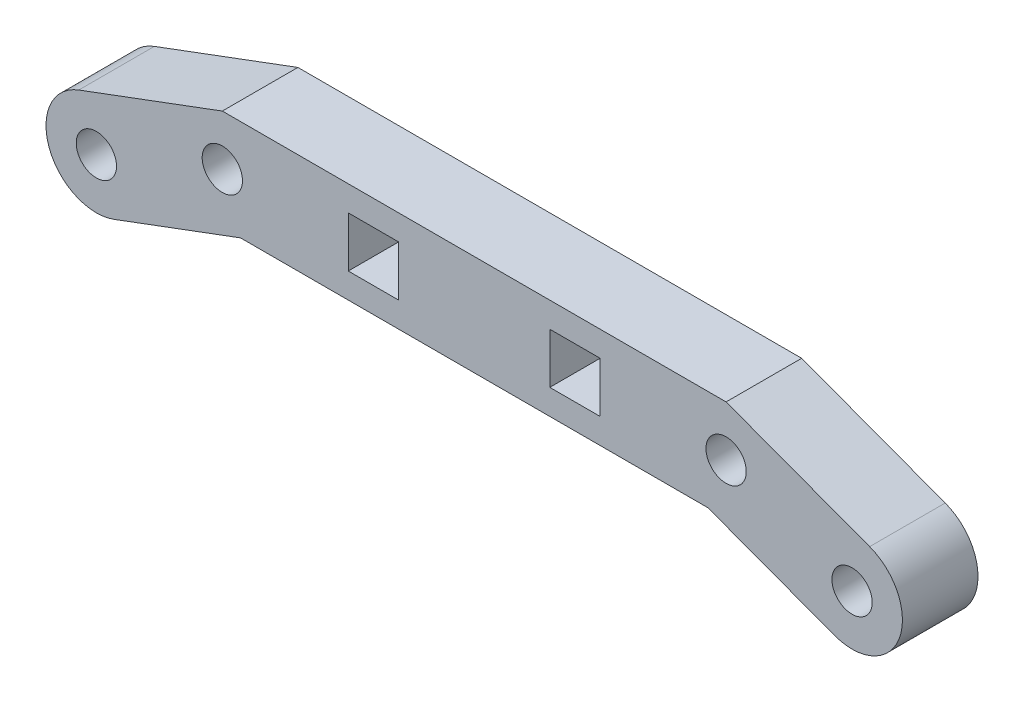
from build123d import *

# Parameters (mm, degrees)
ESBO_O1_R                = 4
ESBO_O1_W                = 10
ESBO_O1_H                = 10
RESSALTO_EXTRUS_O1_DEPTH = 15


with BuildPart() as part:
    # Esboço1 → Ressalto-extrusão1 (new body)
    with BuildSketch(Plane.XY):
        with BuildLine():
            Line((78.495378078, -10.630777402), (50, 0))
            Line((50, 0), (0, 0))
            Line((0, 0), (-50, 0))
            Line((-50, 0), (-78.495378078, -10.630777402))
            ThreePointArc((-78.495378078, -10.630777402), (-84.369222598, -23.495378078), (-71.504621922, -29.369222598))
            Line((-71.504621922, -29.369222598), (-46.390791566, -20))
            Line((-46.390791566, -20), (46.390791566, -20))
            Line((46.390791566, -20), (71.504621922, -29.369222598))
            ThreePointArc((71.504621922, -29.369222598), (84.369222598, -23.495378078), (78.495378078, -10.630777402))
        make_face()
        with Locations((-50, -10)):
            Circle(ESBO_O1_R, mode=Mode.SUBTRACT)
        with Locations(Location((50, -10, 0), (0, 0, 180))):
            Circle(ESBO_O1_R, mode=Mode.SUBTRACT)
        with Locations((-75, -20)):
            Circle(ESBO_O1_R, mode=Mode.SUBTRACT)
        with Locations(Location((75, -20, 0), (0, 0, 180))):
            Circle(ESBO_O1_R, mode=Mode.SUBTRACT)
        with Locations((20, -10)):
            Rectangle(ESBO_O1_W, ESBO_O1_H, mode=Mode.SUBTRACT)
        with Locations((-20, -10)):
            Rectangle(ESBO_O1_W, ESBO_O1_H, mode=Mode.SUBTRACT)
    extrude(amount=RESSALTO_EXTRUS_O1_DEPTH)


solid = part.part
